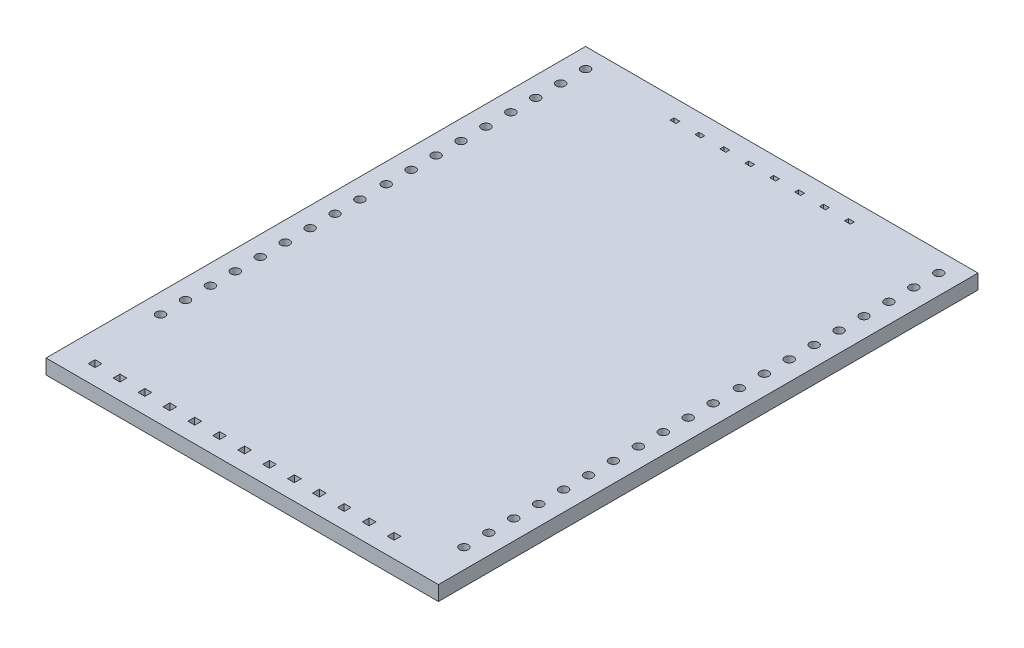
from build123d import *

# Parameters (mm, degrees)
SKETCH_1_W          = 40
SKETCH_1_H          = 55
EXTRUDE_1_DEPTH     = 1.5
SKETCH_2_R          = 0.45
SKETCH_2_W          = 0.7
SKETCH_2_H          = 0.7
SKETCH_2_W_2        = 0.6
SKETCH_2_H_2        = 0.4
CUT_EXTRUDE_1_DEPTH = 35.03674485


with BuildPart() as part:
    # Эскиз1 → Бобышка-Вытянуть1 (new body)
    with BuildSketch(Plane(origin=(0, 0, 0), x_dir=(1, 0, 0), z_dir=(0, 1, 0))):
        Rectangle(SKETCH_1_W, SKETCH_1_H)
    extrude(amount=EXTRUDE_1_DEPTH)

    # Эскиз2 → Вырез-Вытянуть1 (cut, through all)
    with BuildSketch(Plane(origin=(0, 1.5, 0), x_dir=(1, 0, 0), z_dir=(0, 1, 0))):
        with Locations(Location((18, -22.9, 0), (0, 0, 270))):
            Circle(SKETCH_2_R)
        with Locations(Location((18, -20.36, 0), (0, 0, 270))):
            Circle(SKETCH_2_R)
        with Locations(Location((18, -17.82, 0), (0, 0, 270))):
            Circle(SKETCH_2_R)
        with Locations(Location((18, -15.28, 0), (0, 0, 270))):
            Circle(SKETCH_2_R)
        with Locations(Location((18, -12.74, 0), (0, 0, 270))):
            Circle(SKETCH_2_R)
        with Locations(Location((18, -10.2, 0), (0, 0, 270))):
            Circle(SKETCH_2_R)
        with Locations(Location((18, -7.66, 0), (0, 0, 270))):
            Circle(SKETCH_2_R)
        with Locations(Location((18, -5.12, 0), (0, 0, 270))):
            Circle(SKETCH_2_R)
        with Locations(Location((18, -2.58, 0), (0, 0, 270))):
            Circle(SKETCH_2_R)
        with Locations(Location((18, -0.04, 0), (0, 0, 270))):
            Circle(SKETCH_2_R)
        with Locations(Location((18, 2.5, 0), (0, 0, 270))):
            Circle(SKETCH_2_R)
        with Locations(Location((-18, 2.5, 0), (0, 0, 90))):
            Circle(SKETCH_2_R)
        with Locations(Location((-18, -0.04, 0), (0, 0, 90))):
            Circle(SKETCH_2_R)
        with Locations(Location((-18, -2.58, 0), (0, 0, 90))):
            Circle(SKETCH_2_R)
        with Locations(Location((-18, -5.12, 0), (0, 0, 90))):
            Circle(SKETCH_2_R)
        with Locations(Location((-18, -7.66, 0), (0, 0, 90))):
            Circle(SKETCH_2_R)
        with Locations(Location((-18, -10.2, 0), (0, 0, 90))):
            Circle(SKETCH_2_R)
        with Locations(Location((-18, -12.74, 0), (0, 0, 90))):
            Circle(SKETCH_2_R)
        with Locations(Location((-18, -15.28, 0), (0, 0, 90))):
            Circle(SKETCH_2_R)
        with Locations(Location((-18, -17.82, 0), (0, 0, 90))):
            Circle(SKETCH_2_R)
        with Locations(Location((18, 5.18, 0), (0, 0, 270))):
            Circle(SKETCH_2_R)
        with Locations(Location((18, 7.72, 0), (0, 0, 270))):
            Circle(SKETCH_2_R)
        with Locations(Location((18, 10.26, 0), (0, 0, 270))):
            Circle(SKETCH_2_R)
        with Locations(Location((18, 12.8, 0), (0, 0, 270))):
            Circle(SKETCH_2_R)
        with Locations(Location((18, 15.34, 0), (0, 0, 270))):
            Circle(SKETCH_2_R)
        with Locations(Location((18, 17.88, 0), (0, 0, 270))):
            Circle(SKETCH_2_R)
        with Locations(Location((18, 20.42, 0), (0, 0, 270))):
            Circle(SKETCH_2_R)
        with Locations(Location((18, 22.96, 0), (0, 0, 270))):
            Circle(SKETCH_2_R)
        with Locations(Location((18, 25.5, 0), (0, 0, 270))):
            Circle(SKETCH_2_R)
        with Locations(Location((-18, 25.5, 0), (0, 0, 90))):
            Circle(SKETCH_2_R)
        with Locations(Location((-18, 22.96, 0), (0, 0, 90))):
            Circle(SKETCH_2_R)
        with Locations(Location((-18, 20.42, 0), (0, 0, 90))):
            Circle(SKETCH_2_R)
        with Locations(Location((-18, 17.88, 0), (0, 0, 90))):
            Circle(SKETCH_2_R)
        with Locations(Location((-18, 15.34, 0), (0, 0, 90))):
            Circle(SKETCH_2_R)
        with Locations(Location((-18, 12.8, 0), (0, 0, 90))):
            Circle(SKETCH_2_R)
        with Locations(Location((-18, 10.26, 0), (0, 0, 90))):
            Circle(SKETCH_2_R)
        with Locations(Location((-18, 7.72, 0), (0, 0, 90))):
            Circle(SKETCH_2_R)
        with Locations(Location((-18, 5.18, 0), (0, 0, 90))):
            Circle(SKETCH_2_R)
        with Locations((-14.46, -25.5)):
            Rectangle(SKETCH_2_W, SKETCH_2_H)
        with Locations((-17, -25.5)):
            Rectangle(SKETCH_2_W, SKETCH_2_H)
        with Locations((-11.92, -25.5)):
            Rectangle(SKETCH_2_W, SKETCH_2_H)
        with Locations((-9.38, -25.5)):
            Rectangle(SKETCH_2_W, SKETCH_2_H)
        with Locations((-6.84, -25.5)):
            Rectangle(SKETCH_2_W, SKETCH_2_H)
        with Locations((-4.3, -25.5)):
            Rectangle(SKETCH_2_W, SKETCH_2_H)
        with Locations((-1.76, -25.5)):
            Rectangle(SKETCH_2_W, SKETCH_2_H)
        with Locations((0.78, -25.5)):
            Rectangle(SKETCH_2_W, SKETCH_2_H)
        with Locations((3.32, -25.5)):
            Rectangle(SKETCH_2_W, SKETCH_2_H)
        with Locations((5.86, -25.5)):
            Rectangle(SKETCH_2_W, SKETCH_2_H)
        with Locations((8.4, -25.5)):
            Rectangle(SKETCH_2_W, SKETCH_2_H)
        with Locations((10.94, -25.5)):
            Rectangle(SKETCH_2_W, SKETCH_2_H)
        with Locations((13.48, -25.5)):
            Rectangle(SKETCH_2_W, SKETCH_2_H)
        with Locations((6.35, 25.5)):
            Rectangle(SKETCH_2_W_2, SKETCH_2_H_2)
        with Locations((8.89, 25.5)):
            Rectangle(SKETCH_2_W_2, SKETCH_2_H_2)
        with Locations((3.81, 25.5)):
            Rectangle(SKETCH_2_W_2, SKETCH_2_H_2)
        with Locations((1.27, 25.5)):
            Rectangle(SKETCH_2_W_2, SKETCH_2_H_2)
        with Locations((-1.27, 25.5)):
            Rectangle(SKETCH_2_W_2, SKETCH_2_H_2)
        with Locations((-3.81, 25.5)):
            Rectangle(SKETCH_2_W_2, SKETCH_2_H_2)
        with Locations((-6.35, 25.5)):
            Rectangle(SKETCH_2_W_2, SKETCH_2_H_2)
        with Locations((-8.89, 25.5)):
            Rectangle(SKETCH_2_W_2, SKETCH_2_H_2)
    extrude(amount=-CUT_EXTRUDE_1_DEPTH, mode=Mode.SUBTRACT)


solid = part.part
